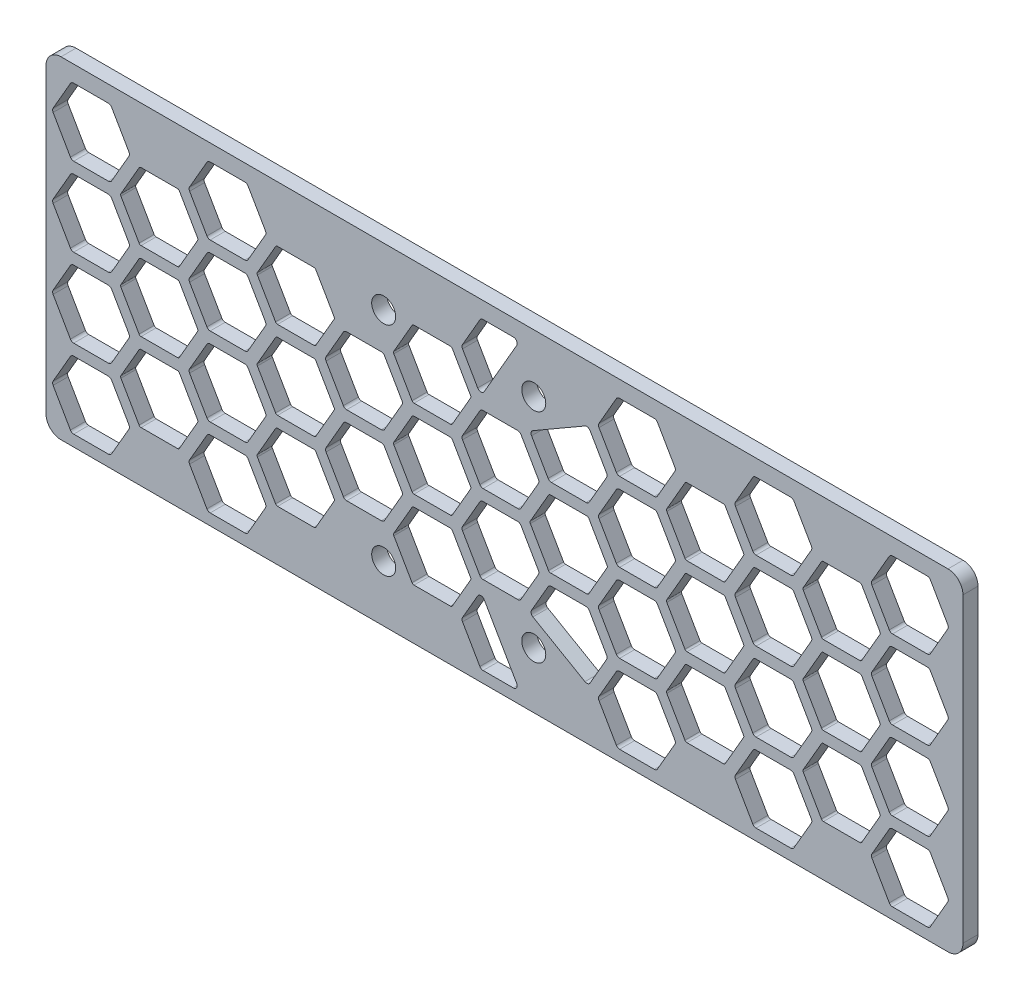
from build123d import *

# Parameters (mm, degrees)
SKETCH_2_W          = 122.2
SKETCH_2_H          = 44.2
SKETCH_2_R          = 1.6
EXTRUDE_1_DEPTH     = 2
CUT_EXTRUDE_1_DEPTH = 2
FILLET_1_R          = 2


with BuildPart() as part:
    # 草图2 → 凸台-拉伸1 (new body)
    with BuildSketch(Plane.XY):
        with Locations((-18.234957185, -14.6)):
            Rectangle(SKETCH_2_W, SKETCH_2_H)
        with Locations((-34.334957185, -0.2)):
            Circle(SKETCH_2_R, mode=Mode.SUBTRACT)
        with Locations((-14.334957185, -0.2)):
            Circle(SKETCH_2_R, mode=Mode.SUBTRACT)
        with Locations((-34.334957185, -29.2)):
            Circle(SKETCH_2_R, mode=Mode.SUBTRACT)
        with Locations((-14.334957185, -29.2)):
            Circle(SKETCH_2_R, mode=Mode.SUBTRACT)
    extrude(amount=EXTRUDE_1_DEPTH)

    # 草图3 → 切除-拉伸1 (cut)
    with BuildSketch(Plane.XY.offset(2)):
        with BuildLine():
            Line((30.732428836, -20.45), (33.041829913, -24.45))
            ThreePointArc((33.041829913, -24.45), (33.224842615, -24.633012702), (33.474842615, -24.7))
            Line((33.474842615, -24.7), (38.093644768, -24.7))
            ThreePointArc((38.093644768, -24.7), (38.343644768, -24.633012702), (38.52665747, -24.45))
            Line((38.52665747, -24.45), (40.836058547, -20.45))
            ThreePointArc((40.836058547, -20.45), (40.903045845, -20.2), (40.836058547, -19.95))
            Line((40.836058547, -19.95), (38.52665747, -15.95))
            ThreePointArc((38.52665747, -15.95), (38.343644768, -15.766987298), (38.093644768, -15.7))
            Line((38.093644768, -15.7), (33.474842615, -15.7))
            ThreePointArc((33.474842615, -15.7), (33.224842615, -15.766987298), (33.041829913, -15.95))
            Line((33.041829913, -15.95), (30.732428836, -19.95))
            ThreePointArc((30.732428836, -19.95), (30.665441538, -20.2), (30.732428836, -20.45))
        make_face()
        with BuildLine():
            Line((-78.386772041, -30.95), (-76.077370964, -34.95))
            ThreePointArc((-76.077370964, -34.95), (-75.894358262, -35.133012702), (-75.644358262, -35.2))
            Line((-75.644358262, -35.2), (-71.025556109, -35.2))
            ThreePointArc((-71.025556109, -35.2), (-70.775556109, -35.133012702), (-70.592543407, -34.95))
            Line((-70.592543407, -34.95), (-68.28314233, -30.95))
            ThreePointArc((-68.28314233, -30.95), (-68.216155032, -30.7), (-68.28314233, -30.45))
            Line((-68.28314233, -30.45), (-70.592543407, -26.45))
            ThreePointArc((-70.592543407, -26.45), (-70.775556109, -26.266987298), (-71.025556109, -26.2))
            Line((-71.025556109, -26.2), (-75.644358262, -26.2))
            ThreePointArc((-75.644358262, -26.2), (-75.894358262, -26.266987298), (-76.077370964, -26.45))
            Line((-76.077370964, -26.45), (-78.386772041, -30.45))
            ThreePointArc((-78.386772041, -30.45), (-78.453759339, -30.7), (-78.386772041, -30.95))
        make_face()
        with BuildLine():
            Line((-78.386772041, -20.45), (-76.077370964, -24.45))
            ThreePointArc((-76.077370964, -24.45), (-75.894358262, -24.633012702), (-75.644358262, -24.7))
            Line((-75.644358262, -24.7), (-71.025556109, -24.7))
            ThreePointArc((-71.025556109, -24.7), (-70.775556109, -24.633012702), (-70.592543407, -24.45))
            Line((-70.592543407, -24.45), (-68.28314233, -20.45))
            ThreePointArc((-68.28314233, -20.45), (-68.216155032, -20.2), (-68.28314233, -19.95))
            Line((-68.28314233, -19.95), (-70.592543407, -15.95))
            ThreePointArc((-70.592543407, -15.95), (-70.775556109, -15.766987298), (-71.025556109, -15.7))
            Line((-71.025556109, -15.7), (-75.644358262, -15.7))
            ThreePointArc((-75.644358262, -15.7), (-75.894358262, -15.766987298), (-76.077370964, -15.95))
            Line((-76.077370964, -15.95), (-78.386772041, -19.95))
            ThreePointArc((-78.386772041, -19.95), (-78.453759339, -20.2), (-78.386772041, -20.45))
        make_face()
        with BuildLine():
            Line((-78.386772041, -9.95), (-76.077370964, -13.95))
            ThreePointArc((-76.077370964, -13.95), (-75.894358262, -14.133012702), (-75.644358262, -14.2))
            Line((-75.644358262, -14.2), (-71.025556109, -14.2))
            ThreePointArc((-71.025556109, -14.2), (-70.775556109, -14.133012702), (-70.592543407, -13.95))
            Line((-70.592543407, -13.95), (-68.28314233, -9.95))
            ThreePointArc((-68.28314233, -9.95), (-68.216155032, -9.7), (-68.28314233, -9.45))
            Line((-68.28314233, -9.45), (-70.592543407, -5.45))
            ThreePointArc((-70.592543407, -5.45), (-70.775556109, -5.266987298), (-71.025556109, -5.2))
            Line((-71.025556109, -5.2), (-75.644358262, -5.2))
            ThreePointArc((-75.644358262, -5.2), (-75.894358262, -5.266987298), (-76.077370964, -5.45))
            Line((-76.077370964, -5.45), (-78.386772041, -9.45))
            ThreePointArc((-78.386772041, -9.45), (-78.453759339, -9.7), (-78.386772041, -9.95))
        make_face()
        with BuildLine():
            Line((-78.386772041, 0.55), (-76.077370964, -3.45))
            ThreePointArc((-76.077370964, -3.45), (-75.894358262, -3.633012702), (-75.644358262, -3.7))
            Line((-75.644358262, -3.7), (-71.025556109, -3.7))
            ThreePointArc((-71.025556109, -3.7), (-70.775556109, -3.633012702), (-70.592543407, -3.45))
            Line((-70.592543407, -3.45), (-68.28314233, 0.55))
            ThreePointArc((-68.28314233, 0.55), (-68.216155032, 0.8), (-68.28314233, 1.05))
            Line((-68.28314233, 1.05), (-70.592543407, 5.05))
            ThreePointArc((-70.592543407, 5.05), (-70.775556109, 5.233012702), (-71.025556109, 5.3))
            Line((-71.025556109, 5.3), (-75.644358262, 5.3))
            ThreePointArc((-75.644358262, 5.3), (-75.894358262, 5.233012702), (-76.077370964, 5.05))
            Line((-76.077370964, 5.05), (-78.386772041, 1.05))
            ThreePointArc((-78.386772041, 1.05), (-78.453759339, 0.8), (-78.386772041, 0.55))
        make_face()
        with BuildLine():
            Line((-69.350373014, -15.101502231), (-66.927236511, -19.298497769))
            ThreePointArc((-66.927236511, -19.298497769), (-66.81632918, -19.409405099), (-66.664826949, -19.45))
            Line((-66.664826949, -19.45), (-61.818553942, -19.45))
            ThreePointArc((-61.818553942, -19.45), (-61.667051711, -19.409405099), (-61.55614438, -19.298497769))
            Line((-61.55614438, -19.298497769), (-59.133007877, -15.101502231))
            ThreePointArc((-59.133007877, -15.101502231), (-59.092412976, -14.95), (-59.133007877, -14.798497769))
            Line((-59.133007877, -14.798497769), (-61.55614438, -10.601502231))
            ThreePointArc((-61.55614438, -10.601502231), (-61.667051711, -10.490594901), (-61.818553942, -10.45))
            Line((-61.818553942, -10.45), (-66.664826949, -10.45))
            ThreePointArc((-66.664826949, -10.45), (-66.81632918, -10.490594901), (-66.927236511, -10.601502231))
            Line((-66.927236511, -10.601502231), (-69.350373014, -14.798497769))
            ThreePointArc((-69.350373014, -14.798497769), (-69.390967915, -14.95), (-69.350373014, -15.101502231))
        make_face()
        with BuildLine():
            Line((-69.350373014, -25.601502231), (-66.927236511, -29.798497769))
            ThreePointArc((-66.927236511, -29.798497769), (-66.81632918, -29.909405099), (-66.664826949, -29.95))
            Line((-66.664826949, -29.95), (-61.818553942, -29.95))
            ThreePointArc((-61.818553942, -29.95), (-61.667051711, -29.909405099), (-61.55614438, -29.798497769))
            Line((-61.55614438, -29.798497769), (-59.133007877, -25.601502231))
            ThreePointArc((-59.133007877, -25.601502231), (-59.092412976, -25.45), (-59.133007877, -25.298497769))
            Line((-59.133007877, -25.298497769), (-61.55614438, -21.101502231))
            ThreePointArc((-61.55614438, -21.101502231), (-61.667051711, -20.990594901), (-61.818553942, -20.95))
            Line((-61.818553942, -20.95), (-66.664826949, -20.95))
            ThreePointArc((-66.664826949, -20.95), (-66.81632918, -20.990594901), (-66.927236511, -21.101502231))
            Line((-66.927236511, -21.101502231), (-69.350373014, -25.298497769))
            ThreePointArc((-69.350373014, -25.298497769), (-69.390967915, -25.45), (-69.350373014, -25.601502231))
        make_face()
        with BuildLine():
            Line((-69.350373014, -4.601502231), (-66.927236511, -8.798497769))
            ThreePointArc((-66.927236511, -8.798497769), (-66.81632918, -8.909405099), (-66.664826949, -8.95))
            Line((-66.664826949, -8.95), (-61.818553942, -8.95))
            ThreePointArc((-61.818553942, -8.95), (-61.667051711, -8.909405099), (-61.55614438, -8.798497769))
            Line((-61.55614438, -8.798497769), (-59.133007877, -4.601502231))
            ThreePointArc((-59.133007877, -4.601502231), (-59.092412976, -4.45), (-59.133007877, -4.298497769))
            Line((-59.133007877, -4.298497769), (-61.55614438, -0.101502231))
            ThreePointArc((-61.55614438, -0.101502231), (-61.667051711, 0.009405099), (-61.818553942, 0.05))
            Line((-61.818553942, 0.05), (-66.664826949, 0.05))
            ThreePointArc((-66.664826949, 0.05), (-66.81632918, 0.009405099), (-66.927236511, -0.101502231))
            Line((-66.927236511, -0.101502231), (-69.350373014, -4.298497769))
            ThreePointArc((-69.350373014, -4.298497769), (-69.390967915, -4.45), (-69.350373014, -4.601502231))
        make_face()
        with BuildLine():
            Line((-60.200238561, -30.95), (-57.890837484, -34.95))
            ThreePointArc((-57.890837484, -34.95), (-57.707824783, -35.133012702), (-57.457824783, -35.2))
            Line((-57.457824783, -35.2), (-52.839022629, -35.2))
            ThreePointArc((-52.839022629, -35.2), (-52.589022629, -35.133012702), (-52.406009927, -34.95))
            Line((-52.406009927, -34.95), (-50.09660885, -30.95))
            ThreePointArc((-50.09660885, -30.95), (-50.029621552, -30.7), (-50.09660885, -30.45))
            Line((-50.09660885, -30.45), (-52.406009927, -26.45))
            ThreePointArc((-52.406009927, -26.45), (-52.589022629, -26.266987298), (-52.839022629, -26.2))
            Line((-52.839022629, -26.2), (-57.457824783, -26.2))
            ThreePointArc((-57.457824783, -26.2), (-57.707824783, -26.266987298), (-57.890837484, -26.45))
            Line((-57.890837484, -26.45), (-60.200238561, -30.45))
            ThreePointArc((-60.200238561, -30.45), (-60.267225859, -30.7), (-60.200238561, -30.95))
        make_face()
        with BuildLine():
            Line((-60.200238561, -20.45), (-57.890837484, -24.45))
            ThreePointArc((-57.890837484, -24.45), (-57.707824783, -24.633012702), (-57.457824783, -24.7))
            Line((-57.457824783, -24.7), (-52.839022629, -24.7))
            ThreePointArc((-52.839022629, -24.7), (-52.589022629, -24.633012702), (-52.406009927, -24.45))
            Line((-52.406009927, -24.45), (-50.09660885, -20.45))
            ThreePointArc((-50.09660885, -20.45), (-50.029621552, -20.2), (-50.09660885, -19.95))
            Line((-50.09660885, -19.95), (-52.406009927, -15.95))
            ThreePointArc((-52.406009927, -15.95), (-52.589022629, -15.766987298), (-52.839022629, -15.7))
            Line((-52.839022629, -15.7), (-57.457824783, -15.7))
            ThreePointArc((-57.457824783, -15.7), (-57.707824783, -15.766987298), (-57.890837484, -15.95))
            Line((-57.890837484, -15.95), (-60.200238561, -19.95))
            ThreePointArc((-60.200238561, -19.95), (-60.267225859, -20.2), (-60.200238561, -20.45))
        make_face()
        with BuildLine():
            Line((-60.200238561, -9.95), (-57.890837484, -13.95))
            ThreePointArc((-57.890837484, -13.95), (-57.707824783, -14.133012702), (-57.457824783, -14.2))
            Line((-57.457824783, -14.2), (-52.839022629, -14.2))
            ThreePointArc((-52.839022629, -14.2), (-52.589022629, -14.133012702), (-52.406009927, -13.95))
            Line((-52.406009927, -13.95), (-50.09660885, -9.95))
            ThreePointArc((-50.09660885, -9.95), (-50.029621552, -9.7), (-50.09660885, -9.45))
            Line((-50.09660885, -9.45), (-52.406009927, -5.45))
            ThreePointArc((-52.406009927, -5.45), (-52.589022629, -5.266987298), (-52.839022629, -5.2))
            Line((-52.839022629, -5.2), (-57.457824783, -5.2))
            ThreePointArc((-57.457824783, -5.2), (-57.707824783, -5.266987298), (-57.890837484, -5.45))
            Line((-57.890837484, -5.45), (-60.200238561, -9.45))
            ThreePointArc((-60.200238561, -9.45), (-60.267225859, -9.7), (-60.200238561, -9.95))
        make_face()
        with BuildLine():
            Line((-60.200238561, 0.55), (-57.890837484, -3.45))
            ThreePointArc((-57.890837484, -3.45), (-57.707824783, -3.633012702), (-57.457824783, -3.7))
            Line((-57.457824783, -3.7), (-52.839022629, -3.7))
            ThreePointArc((-52.839022629, -3.7), (-52.589022629, -3.633012702), (-52.406009927, -3.45))
            Line((-52.406009927, -3.45), (-50.09660885, 0.55))
            ThreePointArc((-50.09660885, 0.55), (-50.029621552, 0.8), (-50.09660885, 1.05))
            Line((-50.09660885, 1.05), (-52.406009927, 5.05))
            ThreePointArc((-52.406009927, 5.05), (-52.589022629, 5.233012702), (-52.839022629, 5.3))
            Line((-52.839022629, 5.3), (-57.457824783, 5.3))
            ThreePointArc((-57.457824783, 5.3), (-57.707824783, 5.233012702), (-57.890837484, 5.05))
            Line((-57.890837484, 5.05), (-60.200238561, 1.05))
            ThreePointArc((-60.200238561, 1.05), (-60.267225859, 0.8), (-60.200238561, 0.55))
        make_face()
        with BuildLine():
            Line((-51.163839535, -15.101502231), (-48.740703032, -19.298497769))
            ThreePointArc((-48.740703032, -19.298497769), (-48.629795701, -19.409405099), (-48.478293469, -19.45))
            Line((-48.478293469, -19.45), (-43.632020463, -19.45))
            ThreePointArc((-43.632020463, -19.45), (-43.480518232, -19.409405099), (-43.369610901, -19.298497769))
            Line((-43.369610901, -19.298497769), (-40.946474397, -15.101502231))
            ThreePointArc((-40.946474397, -15.101502231), (-40.905879497, -14.95), (-40.946474397, -14.798497769))
            Line((-40.946474397, -14.798497769), (-43.369610901, -10.601502231))
            ThreePointArc((-43.369610901, -10.601502231), (-43.480518232, -10.490594901), (-43.632020463, -10.45))
            Line((-43.632020463, -10.45), (-48.478293469, -10.45))
            ThreePointArc((-48.478293469, -10.45), (-48.629795701, -10.490594901), (-48.740703032, -10.601502231))
            Line((-48.740703032, -10.601502231), (-51.163839535, -14.798497769))
            ThreePointArc((-51.163839535, -14.798497769), (-51.204434435, -14.95), (-51.163839535, -15.101502231))
        make_face()
        with BuildLine():
            Line((-51.163839535, -25.601502231), (-48.740703032, -29.798497769))
            ThreePointArc((-48.740703032, -29.798497769), (-48.629795701, -29.909405099), (-48.478293469, -29.95))
            Line((-48.478293469, -29.95), (-43.632020463, -29.95))
            ThreePointArc((-43.632020463, -29.95), (-43.480518232, -29.909405099), (-43.369610901, -29.798497769))
            Line((-43.369610901, -29.798497769), (-40.946474397, -25.601502231))
            ThreePointArc((-40.946474397, -25.601502231), (-40.905879497, -25.45), (-40.946474397, -25.298497769))
            Line((-40.946474397, -25.298497769), (-43.369610901, -21.101502231))
            ThreePointArc((-43.369610901, -21.101502231), (-43.480518232, -20.990594901), (-43.632020463, -20.95))
            Line((-43.632020463, -20.95), (-48.478293469, -20.95))
            ThreePointArc((-48.478293469, -20.95), (-48.629795701, -20.990594901), (-48.740703032, -21.101502231))
            Line((-48.740703032, -21.101502231), (-51.163839535, -25.298497769))
            ThreePointArc((-51.163839535, -25.298497769), (-51.204434435, -25.45), (-51.163839535, -25.601502231))
        make_face()
        with BuildLine():
            Line((-51.163839535, -4.601502231), (-48.740703032, -8.798497769))
            ThreePointArc((-48.740703032, -8.798497769), (-48.629795701, -8.909405099), (-48.478293469, -8.95))
            Line((-48.478293469, -8.95), (-43.632020463, -8.95))
            ThreePointArc((-43.632020463, -8.95), (-43.480518232, -8.909405099), (-43.369610901, -8.798497769))
            Line((-43.369610901, -8.798497769), (-40.946474397, -4.601502231))
            ThreePointArc((-40.946474397, -4.601502231), (-40.905879497, -4.45), (-40.946474397, -4.298497769))
            Line((-40.946474397, -4.298497769), (-43.369610901, -0.101502231))
            ThreePointArc((-43.369610901, -0.101502231), (-43.480518232, 0.009405099), (-43.632020463, 0.05))
            Line((-43.632020463, 0.05), (-48.478293469, 0.05))
            ThreePointArc((-48.478293469, 0.05), (-48.629795701, 0.009405099), (-48.740703032, -0.101502231))
            Line((-48.740703032, -0.101502231), (-51.163839535, -4.298497769))
            ThreePointArc((-51.163839535, -4.298497769), (-51.204434435, -4.45), (-51.163839535, -4.601502231))
        make_face()
        with BuildLine():
            Line((-42.013705082, -20.45), (-39.704304005, -24.45))
            ThreePointArc((-39.704304005, -24.45), (-39.521291303, -24.633012702), (-39.271291303, -24.7))
            Line((-39.271291303, -24.7), (-34.65248915, -24.7))
            ThreePointArc((-34.65248915, -24.7), (-34.40248915, -24.633012702), (-34.219476448, -24.45))
            Line((-34.219476448, -24.45), (-31.910075371, -20.45))
            ThreePointArc((-31.910075371, -20.45), (-31.843088073, -20.2), (-31.910075371, -19.95))
            Line((-31.910075371, -19.95), (-34.219476448, -15.95))
            ThreePointArc((-34.219476448, -15.95), (-34.40248915, -15.766987298), (-34.65248915, -15.7))
            Line((-34.65248915, -15.7), (-39.271291303, -15.7))
            ThreePointArc((-39.271291303, -15.7), (-39.521291303, -15.766987298), (-39.704304005, -15.95))
            Line((-39.704304005, -15.95), (-42.013705082, -19.95))
            ThreePointArc((-42.013705082, -19.95), (-42.08069238, -20.2), (-42.013705082, -20.45))
        make_face()
        with BuildLine():
            Line((-42.013705082, -9.95), (-39.704304005, -13.95))
            ThreePointArc((-39.704304005, -13.95), (-39.521291303, -14.133012702), (-39.271291303, -14.2))
            Line((-39.271291303, -14.2), (-34.65248915, -14.2))
            ThreePointArc((-34.65248915, -14.2), (-34.40248915, -14.133012702), (-34.219476448, -13.95))
            Line((-34.219476448, -13.95), (-31.910075371, -9.95))
            ThreePointArc((-31.910075371, -9.95), (-31.843088073, -9.7), (-31.910075371, -9.45))
            Line((-31.910075371, -9.45), (-34.219476448, -5.45))
            ThreePointArc((-34.219476448, -5.45), (-34.40248915, -5.266987298), (-34.65248915, -5.2))
            Line((-34.65248915, -5.2), (-39.271291303, -5.2))
            ThreePointArc((-39.271291303, -5.2), (-39.521291303, -5.266987298), (-39.704304005, -5.45))
            Line((-39.704304005, -5.45), (-42.013705082, -9.45))
            ThreePointArc((-42.013705082, -9.45), (-42.08069238, -9.7), (-42.013705082, -9.95))
        make_face()
        with BuildLine():
            Line((-32.977306055, -15.101502231), (-30.554169552, -19.298497769))
            ThreePointArc((-30.554169552, -19.298497769), (-30.443262221, -19.409405099), (-30.29175999, -19.45))
            Line((-30.29175999, -19.45), (-25.445486983, -19.45))
            ThreePointArc((-25.445486983, -19.45), (-25.293984752, -19.409405099), (-25.183077421, -19.298497769))
            Line((-25.183077421, -19.298497769), (-22.759940918, -15.101502231))
            ThreePointArc((-22.759940918, -15.101502231), (-22.719346017, -14.95), (-22.759940918, -14.798497769))
            Line((-22.759940918, -14.798497769), (-25.183077421, -10.601502231))
            ThreePointArc((-25.183077421, -10.601502231), (-25.293984752, -10.490594901), (-25.445486983, -10.45))
            Line((-25.445486983, -10.45), (-30.29175999, -10.45))
            ThreePointArc((-30.29175999, -10.45), (-30.443262221, -10.490594901), (-30.554169552, -10.601502231))
            Line((-30.554169552, -10.601502231), (-32.977306055, -14.798497769))
            ThreePointArc((-32.977306055, -14.798497769), (-33.017900956, -14.95), (-32.977306055, -15.101502231))
        make_face()
        with BuildLine():
            Line((-32.977306055, -25.601502231), (-30.554169552, -29.798497769))
            ThreePointArc((-30.554169552, -29.798497769), (-30.443262221, -29.909405099), (-30.29175999, -29.95))
            Line((-30.29175999, -29.95), (-25.445486983, -29.95))
            ThreePointArc((-25.445486983, -29.95), (-25.293984752, -29.909405099), (-25.183077421, -29.798497769))
            Line((-25.183077421, -29.798497769), (-22.759940918, -25.601502231))
            ThreePointArc((-22.759940918, -25.601502231), (-22.719346017, -25.45), (-22.759940918, -25.298497769))
            Line((-22.759940918, -25.298497769), (-25.183077421, -21.101502231))
            ThreePointArc((-25.183077421, -21.101502231), (-25.293984752, -20.990594901), (-25.445486983, -20.95))
            Line((-25.445486983, -20.95), (-30.29175999, -20.95))
            ThreePointArc((-30.29175999, -20.95), (-30.443262221, -20.990594901), (-30.554169552, -21.101502231))
            Line((-30.554169552, -21.101502231), (-32.977306055, -25.298497769))
            ThreePointArc((-32.977306055, -25.298497769), (-33.017900956, -25.45), (-32.977306055, -25.601502231))
        make_face()
        with BuildLine():
            Line((-32.977306055, -4.601502231), (-30.554169552, -8.798497769))
            ThreePointArc((-30.554169552, -8.798497769), (-30.443262221, -8.909405099), (-30.29175999, -8.95))
            Line((-30.29175999, -8.95), (-25.445486983, -8.95))
            ThreePointArc((-25.445486983, -8.95), (-25.293984752, -8.909405099), (-25.183077421, -8.798497769))
            Line((-25.183077421, -8.798497769), (-22.759940918, -4.601502231))
            ThreePointArc((-22.759940918, -4.601502231), (-22.719346017, -4.45), (-22.759940918, -4.298497769))
            Line((-22.759940918, -4.298497769), (-25.183077421, -0.101502231))
            ThreePointArc((-25.183077421, -0.101502231), (-25.293984752, 0.009405099), (-25.445486983, 0.05))
            Line((-25.445486983, 0.05), (-30.29175999, 0.05))
            ThreePointArc((-30.29175999, 0.05), (-30.443262221, 0.009405099), (-30.554169552, -0.101502231))
            Line((-30.554169552, -0.101502231), (-32.977306055, -4.298497769))
            ThreePointArc((-32.977306055, -4.298497769), (-33.017900956, -4.45), (-32.977306055, -4.601502231))
        make_face()
        with BuildLine():
            Line((-23.827171602, -20.45), (-21.517770526, -24.45))
            ThreePointArc((-21.517770526, -24.45), (-21.334757824, -24.633012702), (-21.084757824, -24.7))
            Line((-21.084757824, -24.7), (-16.46595567, -24.7))
            ThreePointArc((-16.46595567, -24.7), (-16.21595567, -24.633012702), (-16.032942968, -24.45))
            Line((-16.032942968, -24.45), (-13.723541891, -20.45))
            ThreePointArc((-13.723541891, -20.45), (-13.656554593, -20.2), (-13.723541891, -19.95))
            Line((-13.723541891, -19.95), (-16.032942968, -15.95))
            ThreePointArc((-16.032942968, -15.95), (-16.21595567, -15.766987298), (-16.46595567, -15.7))
            Line((-16.46595567, -15.7), (-21.084757824, -15.7))
            ThreePointArc((-21.084757824, -15.7), (-21.334757824, -15.766987298), (-21.517770526, -15.95))
            Line((-21.517770526, -15.95), (-23.827171602, -19.95))
            ThreePointArc((-23.827171602, -19.95), (-23.8941589, -20.2), (-23.827171602, -20.45))
        make_face()
        with BuildLine():
            Line((-23.827171602, -9.95), (-21.517770526, -13.95))
            ThreePointArc((-21.517770526, -13.95), (-21.334757824, -14.133012702), (-21.084757824, -14.2))
            Line((-21.084757824, -14.2), (-16.46595567, -14.2))
            ThreePointArc((-16.46595567, -14.2), (-16.21595567, -14.133012702), (-16.032942968, -13.95))
            Line((-16.032942968, -13.95), (-13.723541891, -9.95))
            ThreePointArc((-13.723541891, -9.95), (-13.656554593, -9.7), (-13.723541891, -9.45))
            Line((-13.723541891, -9.45), (-16.032942968, -5.45))
            ThreePointArc((-16.032942968, -5.45), (-16.21595567, -5.266987298), (-16.46595567, -5.2))
            Line((-16.46595567, -5.2), (-21.084757824, -5.2))
            ThreePointArc((-21.084757824, -5.2), (-21.334757824, -5.266987298), (-21.517770526, -5.45))
            Line((-21.517770526, -5.45), (-23.827171602, -9.45))
            ThreePointArc((-23.827171602, -9.45), (-23.8941589, -9.7), (-23.827171602, -9.95))
        make_face()
        with BuildLine():
            Line((-14.790772576, -15.101502231), (-12.367636073, -19.298497769))
            ThreePointArc((-12.367636073, -19.298497769), (-12.256728742, -19.409405099), (-12.10522651, -19.45))
            Line((-12.10522651, -19.45), (-7.258953504, -19.45))
            ThreePointArc((-7.258953504, -19.45), (-7.107451273, -19.409405099), (-6.996543942, -19.298497769))
            Line((-6.996543942, -19.298497769), (-4.573407439, -15.101502231))
            ThreePointArc((-4.573407439, -15.101502231), (-4.532812538, -14.95), (-4.573407439, -14.798497769))
            Line((-4.573407439, -14.798497769), (-6.996543942, -10.601502231))
            ThreePointArc((-6.996543942, -10.601502231), (-7.107451273, -10.490594901), (-7.258953504, -10.45))
            Line((-7.258953504, -10.45), (-12.10522651, -10.45))
            ThreePointArc((-12.10522651, -10.45), (-12.256728742, -10.490594901), (-12.367636073, -10.601502231))
            Line((-12.367636073, -10.601502231), (-14.790772576, -14.798497769))
            ThreePointArc((-14.790772576, -14.798497769), (-14.831367476, -14.95), (-14.790772576, -15.101502231))
        make_face()
        with BuildLine():
            Line((-5.640638123, -30.95), (-3.331237046, -34.95))
            ThreePointArc((-3.331237046, -34.95), (-3.148224344, -35.133012702), (-2.898224344, -35.2))
            Line((-2.898224344, -35.2), (1.720577809, -35.2))
            ThreePointArc((1.720577809, -35.2), (1.970577809, -35.133012702), (2.153590511, -34.95))
            Line((2.153590511, -34.95), (4.462991588, -30.95))
            ThreePointArc((4.462991588, -30.95), (4.529978886, -30.7), (4.462991588, -30.45))
            Line((4.462991588, -30.45), (2.153590511, -26.45))
            ThreePointArc((2.153590511, -26.45), (1.970577809, -26.266987298), (1.720577809, -26.2))
            Line((1.720577809, -26.2), (-2.898224344, -26.2))
            ThreePointArc((-2.898224344, -26.2), (-3.148224344, -26.266987298), (-3.331237046, -26.45))
            Line((-3.331237046, -26.45), (-5.640638123, -30.45))
            ThreePointArc((-5.640638123, -30.45), (-5.707625421, -30.7), (-5.640638123, -30.95))
        make_face()
        with BuildLine():
            Line((-5.640638123, -20.45), (-3.331237046, -24.45))
            ThreePointArc((-3.331237046, -24.45), (-3.148224344, -24.633012702), (-2.898224344, -24.7))
            Line((-2.898224344, -24.7), (1.720577809, -24.7))
            ThreePointArc((1.720577809, -24.7), (1.970577809, -24.633012702), (2.153590511, -24.45))
            Line((2.153590511, -24.45), (4.462991588, -20.45))
            ThreePointArc((4.462991588, -20.45), (4.529978886, -20.2), (4.462991588, -19.95))
            Line((4.462991588, -19.95), (2.153590511, -15.95))
            ThreePointArc((2.153590511, -15.95), (1.970577809, -15.766987298), (1.720577809, -15.7))
            Line((1.720577809, -15.7), (-2.898224344, -15.7))
            ThreePointArc((-2.898224344, -15.7), (-3.148224344, -15.766987298), (-3.331237046, -15.95))
            Line((-3.331237046, -15.95), (-5.640638123, -19.95))
            ThreePointArc((-5.640638123, -19.95), (-5.707625421, -20.2), (-5.640638123, -20.45))
        make_face()
        with BuildLine():
            Line((-5.640638123, -9.95), (-3.331237046, -13.95))
            ThreePointArc((-3.331237046, -13.95), (-3.148224344, -14.133012702), (-2.898224344, -14.2))
            Line((-2.898224344, -14.2), (1.720577809, -14.2))
            ThreePointArc((1.720577809, -14.2), (1.970577809, -14.133012702), (2.153590511, -13.95))
            Line((2.153590511, -13.95), (4.462991588, -9.95))
            ThreePointArc((4.462991588, -9.95), (4.529978886, -9.7), (4.462991588, -9.45))
            Line((4.462991588, -9.45), (2.153590511, -5.45))
            ThreePointArc((2.153590511, -5.45), (1.970577809, -5.266987298), (1.720577809, -5.2))
            Line((1.720577809, -5.2), (-2.898224344, -5.2))
            ThreePointArc((-2.898224344, -5.2), (-3.148224344, -5.266987298), (-3.331237046, -5.45))
            Line((-3.331237046, -5.45), (-5.640638123, -9.45))
            ThreePointArc((-5.640638123, -9.45), (-5.707625421, -9.7), (-5.640638123, -9.95))
        make_face()
        with BuildLine():
            Line((-5.640638123, 0.55), (-3.331237046, -3.45))
            ThreePointArc((-3.331237046, -3.45), (-3.148224344, -3.633012702), (-2.898224344, -3.7))
            Line((-2.898224344, -3.7), (1.720577809, -3.7))
            ThreePointArc((1.720577809, -3.7), (1.970577809, -3.633012702), (2.153590511, -3.45))
            Line((2.153590511, -3.45), (4.462991588, 0.55))
            ThreePointArc((4.462991588, 0.55), (4.529978886, 0.8), (4.462991588, 1.05))
            Line((4.462991588, 1.05), (2.153590511, 5.05))
            ThreePointArc((2.153590511, 5.05), (1.970577809, 5.233012702), (1.720577809, 5.3))
            Line((1.720577809, 5.3), (-2.898224344, 5.3))
            ThreePointArc((-2.898224344, 5.3), (-3.148224344, 5.233012702), (-3.331237046, 5.05))
            Line((-3.331237046, 5.05), (-5.640638123, 1.05))
            ThreePointArc((-5.640638123, 1.05), (-5.707625421, 0.8), (-5.640638123, 0.55))
        make_face()
        with BuildLine():
            Line((3.395760904, -15.101502231), (5.818897407, -19.298497769))
            ThreePointArc((5.818897407, -19.298497769), (5.929804738, -19.409405099), (6.081306969, -19.45))
            Line((6.081306969, -19.45), (10.927579976, -19.45))
            ThreePointArc((10.927579976, -19.45), (11.079082207, -19.409405099), (11.189989538, -19.298497769))
            Line((11.189989538, -19.298497769), (13.613126041, -15.101502231))
            ThreePointArc((13.613126041, -15.101502231), (13.653720942, -14.95), (13.613126041, -14.798497769))
            Line((13.613126041, -14.798497769), (11.189989538, -10.601502231))
            ThreePointArc((11.189989538, -10.601502231), (11.079082207, -10.490594901), (10.927579976, -10.45))
            Line((10.927579976, -10.45), (6.081306969, -10.45))
            ThreePointArc((6.081306969, -10.45), (5.929804738, -10.490594901), (5.818897407, -10.601502231))
            Line((5.818897407, -10.601502231), (3.395760904, -14.798497769))
            ThreePointArc((3.395760904, -14.798497769), (3.355166003, -14.95), (3.395760904, -15.101502231))
        make_face()
        with BuildLine():
            Line((3.395760904, -25.601502231), (5.818897407, -29.798497769))
            ThreePointArc((5.818897407, -29.798497769), (5.929804738, -29.909405099), (6.081306969, -29.95))
            Line((6.081306969, -29.95), (10.927579976, -29.95))
            ThreePointArc((10.927579976, -29.95), (11.079082207, -29.909405099), (11.189989538, -29.798497769))
            Line((11.189989538, -29.798497769), (13.613126041, -25.601502231))
            ThreePointArc((13.613126041, -25.601502231), (13.653720942, -25.45), (13.613126041, -25.298497769))
            Line((13.613126041, -25.298497769), (11.189989538, -21.101502231))
            ThreePointArc((11.189989538, -21.101502231), (11.079082207, -20.990594901), (10.927579976, -20.95))
            Line((10.927579976, -20.95), (6.081306969, -20.95))
            ThreePointArc((6.081306969, -20.95), (5.929804738, -20.990594901), (5.818897407, -21.101502231))
            Line((5.818897407, -21.101502231), (3.395760904, -25.298497769))
            ThreePointArc((3.395760904, -25.298497769), (3.355166003, -25.45), (3.395760904, -25.601502231))
        make_face()
        with BuildLine():
            Line((3.395760904, -4.601502231), (5.818897407, -8.798497769))
            ThreePointArc((5.818897407, -8.798497769), (5.929804738, -8.909405099), (6.081306969, -8.95))
            Line((6.081306969, -8.95), (10.927579976, -8.95))
            ThreePointArc((10.927579976, -8.95), (11.079082207, -8.909405099), (11.189989538, -8.798497769))
            Line((11.189989538, -8.798497769), (13.613126041, -4.601502231))
            ThreePointArc((13.613126041, -4.601502231), (13.653720942, -4.45), (13.613126041, -4.298497769))
            Line((13.613126041, -4.298497769), (11.189989538, -0.101502231))
            ThreePointArc((11.189989538, -0.101502231), (11.079082207, 0.009405099), (10.927579976, 0.05))
            Line((10.927579976, 0.05), (6.081306969, 0.05))
            ThreePointArc((6.081306969, 0.05), (5.929804738, 0.009405099), (5.818897407, -0.101502231))
            Line((5.818897407, -0.101502231), (3.395760904, -4.298497769))
            ThreePointArc((3.395760904, -4.298497769), (3.355166003, -4.45), (3.395760904, -4.601502231))
        make_face()
        with BuildLine():
            Line((12.545895357, -30.95), (14.855296433, -34.95))
            ThreePointArc((14.855296433, -34.95), (15.038309135, -35.133012702), (15.288309135, -35.2))
            Line((15.288309135, -35.2), (19.907111289, -35.2))
            ThreePointArc((19.907111289, -35.2), (20.157111289, -35.133012702), (20.340123991, -34.95))
            Line((20.340123991, -34.95), (22.649525067, -30.95))
            ThreePointArc((22.649525067, -30.95), (22.716512366, -30.7), (22.649525067, -30.45))
            Line((22.649525067, -30.45), (20.340123991, -26.45))
            ThreePointArc((20.340123991, -26.45), (20.157111289, -26.266987298), (19.907111289, -26.2))
            Line((19.907111289, -26.2), (15.288309135, -26.2))
            ThreePointArc((15.288309135, -26.2), (15.038309135, -26.266987298), (14.855296433, -26.45))
            Line((14.855296433, -26.45), (12.545895357, -30.45))
            ThreePointArc((12.545895357, -30.45), (12.478908059, -30.7), (12.545895357, -30.95))
        make_face()
        with BuildLine():
            Line((12.545895357, -20.45), (14.855296433, -24.45))
            ThreePointArc((14.855296433, -24.45), (15.038309135, -24.633012702), (15.288309135, -24.7))
            Line((15.288309135, -24.7), (19.907111289, -24.7))
            ThreePointArc((19.907111289, -24.7), (20.157111289, -24.633012702), (20.340123991, -24.45))
            Line((20.340123991, -24.45), (22.649525067, -20.45))
            ThreePointArc((22.649525067, -20.45), (22.716512366, -20.2), (22.649525067, -19.95))
            Line((22.649525067, -19.95), (20.340123991, -15.95))
            ThreePointArc((20.340123991, -15.95), (20.157111289, -15.766987298), (19.907111289, -15.7))
            Line((19.907111289, -15.7), (15.288309135, -15.7))
            ThreePointArc((15.288309135, -15.7), (15.038309135, -15.766987298), (14.855296433, -15.95))
            Line((14.855296433, -15.95), (12.545895357, -19.95))
            ThreePointArc((12.545895357, -19.95), (12.478908059, -20.2), (12.545895357, -20.45))
        make_face()
        with BuildLine():
            Line((12.545895357, -9.95), (14.855296433, -13.95))
            ThreePointArc((14.855296433, -13.95), (15.038309135, -14.133012702), (15.288309135, -14.2))
            Line((15.288309135, -14.2), (19.907111289, -14.2))
            ThreePointArc((19.907111289, -14.2), (20.157111289, -14.133012702), (20.340123991, -13.95))
            Line((20.340123991, -13.95), (22.649525067, -9.95))
            ThreePointArc((22.649525067, -9.95), (22.716512366, -9.7), (22.649525067, -9.45))
            Line((22.649525067, -9.45), (20.340123991, -5.45))
            ThreePointArc((20.340123991, -5.45), (20.157111289, -5.266987298), (19.907111289, -5.2))
            Line((19.907111289, -5.2), (15.288309135, -5.2))
            ThreePointArc((15.288309135, -5.2), (15.038309135, -5.266987298), (14.855296433, -5.45))
            Line((14.855296433, -5.45), (12.545895357, -9.45))
            ThreePointArc((12.545895357, -9.45), (12.478908059, -9.7), (12.545895357, -9.95))
        make_face()
        with BuildLine():
            Line((12.545895357, 0.55), (14.855296433, -3.45))
            ThreePointArc((14.855296433, -3.45), (15.038309135, -3.633012702), (15.288309135, -3.7))
            Line((15.288309135, -3.7), (19.907111289, -3.7))
            ThreePointArc((19.907111289, -3.7), (20.157111289, -3.633012702), (20.340123991, -3.45))
            Line((20.340123991, -3.45), (22.649525067, 0.55))
            ThreePointArc((22.649525067, 0.55), (22.716512366, 0.8), (22.649525067, 1.05))
            Line((22.649525067, 1.05), (20.340123991, 5.05))
            ThreePointArc((20.340123991, 5.05), (20.157111289, 5.233012702), (19.907111289, 5.3))
            Line((19.907111289, 5.3), (15.288309135, 5.3))
            ThreePointArc((15.288309135, 5.3), (15.038309135, 5.233012702), (14.855296433, 5.05))
            Line((14.855296433, 5.05), (12.545895357, 1.05))
            ThreePointArc((12.545895357, 1.05), (12.478908059, 0.8), (12.545895357, 0.55))
        make_face()
        with BuildLine():
            Line((21.582294383, -15.101502231), (24.005430886, -19.298497769))
            ThreePointArc((24.005430886, -19.298497769), (24.116338217, -19.409405099), (24.267840449, -19.45))
            Line((24.267840449, -19.45), (29.114113455, -19.45))
            ThreePointArc((29.114113455, -19.45), (29.265615686, -19.409405099), (29.376523017, -19.298497769))
            Line((29.376523017, -19.298497769), (31.79965952, -15.101502231))
            ThreePointArc((31.79965952, -15.101502231), (31.840254421, -14.95), (31.79965952, -14.798497769))
            Line((31.79965952, -14.798497769), (29.376523017, -10.601502231))
            ThreePointArc((29.376523017, -10.601502231), (29.265615686, -10.490594901), (29.114113455, -10.45))
            Line((29.114113455, -10.45), (24.267840449, -10.45))
            ThreePointArc((24.267840449, -10.45), (24.116338217, -10.490594901), (24.005430886, -10.601502231))
            Line((24.005430886, -10.601502231), (21.582294383, -14.798497769))
            ThreePointArc((21.582294383, -14.798497769), (21.541699483, -14.95), (21.582294383, -15.101502231))
        make_face()
        with BuildLine():
            Line((21.582294383, -25.601502231), (24.005430886, -29.798497769))
            ThreePointArc((24.005430886, -29.798497769), (24.116338217, -29.909405099), (24.267840449, -29.95))
            Line((24.267840449, -29.95), (29.114113455, -29.95))
            ThreePointArc((29.114113455, -29.95), (29.265615686, -29.909405099), (29.376523017, -29.798497769))
            Line((29.376523017, -29.798497769), (31.79965952, -25.601502231))
            ThreePointArc((31.79965952, -25.601502231), (31.840254421, -25.45), (31.79965952, -25.298497769))
            Line((31.79965952, -25.298497769), (29.376523017, -21.101502231))
            ThreePointArc((29.376523017, -21.101502231), (29.265615686, -20.990594901), (29.114113455, -20.95))
            Line((29.114113455, -20.95), (24.267840449, -20.95))
            ThreePointArc((24.267840449, -20.95), (24.116338217, -20.990594901), (24.005430886, -21.101502231))
            Line((24.005430886, -21.101502231), (21.582294383, -25.298497769))
            ThreePointArc((21.582294383, -25.298497769), (21.541699483, -25.45), (21.582294383, -25.601502231))
        make_face()
        with BuildLine():
            Line((21.582294383, -4.601502231), (24.005430886, -8.798497769))
            ThreePointArc((24.005430886, -8.798497769), (24.116338217, -8.909405099), (24.267840449, -8.95))
            Line((24.267840449, -8.95), (29.114113455, -8.95))
            ThreePointArc((29.114113455, -8.95), (29.265615686, -8.909405099), (29.376523017, -8.798497769))
            Line((29.376523017, -8.798497769), (31.79965952, -4.601502231))
            ThreePointArc((31.79965952, -4.601502231), (31.840254421, -4.45), (31.79965952, -4.298497769))
            Line((31.79965952, -4.298497769), (29.376523017, -0.101502231))
            ThreePointArc((29.376523017, -0.101502231), (29.265615686, 0.009405099), (29.114113455, 0.05))
            Line((29.114113455, 0.05), (24.267840449, 0.05))
            ThreePointArc((24.267840449, 0.05), (24.116338217, 0.009405099), (24.005430886, -0.101502231))
            Line((24.005430886, -0.101502231), (21.582294383, -4.298497769))
            ThreePointArc((21.582294383, -4.298497769), (21.541699483, -4.45), (21.582294383, -4.601502231))
        make_face()
        with BuildLine():
            Line((30.732428836, -30.95), (33.041829913, -34.95))
            ThreePointArc((33.041829913, -34.95), (33.224842615, -35.133012702), (33.474842615, -35.2))
            Line((33.474842615, -35.2), (38.093644768, -35.2))
            ThreePointArc((38.093644768, -35.2), (38.343644768, -35.133012702), (38.52665747, -34.95))
            Line((38.52665747, -34.95), (40.836058547, -30.95))
            ThreePointArc((40.836058547, -30.95), (40.903045845, -30.7), (40.836058547, -30.45))
            Line((40.836058547, -30.45), (38.52665747, -26.45))
            ThreePointArc((38.52665747, -26.45), (38.343644768, -26.266987298), (38.093644768, -26.2))
            Line((38.093644768, -26.2), (33.474842615, -26.2))
            ThreePointArc((33.474842615, -26.2), (33.224842615, -26.266987298), (33.041829913, -26.45))
            Line((33.041829913, -26.45), (30.732428836, -30.45))
            ThreePointArc((30.732428836, -30.45), (30.665441538, -30.7), (30.732428836, -30.95))
        make_face()
        with BuildLine():
            Line((30.732428836, -9.95), (33.041829913, -13.95))
            ThreePointArc((33.041829913, -13.95), (33.224842615, -14.133012702), (33.474842615, -14.2))
            Line((33.474842615, -14.2), (38.093644768, -14.2))
            ThreePointArc((38.093644768, -14.2), (38.343644768, -14.133012702), (38.52665747, -13.95))
            Line((38.52665747, -13.95), (40.836058547, -9.95))
            ThreePointArc((40.836058547, -9.95), (40.903045845, -9.7), (40.836058547, -9.45))
            Line((40.836058547, -9.45), (38.52665747, -5.45))
            ThreePointArc((38.52665747, -5.45), (38.343644768, -5.266987298), (38.093644768, -5.2))
            Line((38.093644768, -5.2), (33.474842615, -5.2))
            ThreePointArc((33.474842615, -5.2), (33.224842615, -5.266987298), (33.041829913, -5.45))
            Line((33.041829913, -5.45), (30.732428836, -9.45))
            ThreePointArc((30.732428836, -9.45), (30.665441538, -9.7), (30.732428836, -9.95))
        make_face()
        with BuildLine():
            Line((30.732428836, 0.55), (33.041829913, -3.45))
            ThreePointArc((33.041829913, -3.45), (33.224842615, -3.633012702), (33.474842615, -3.7))
            Line((33.474842615, -3.7), (38.093644768, -3.7))
            ThreePointArc((38.093644768, -3.7), (38.343644768, -3.633012702), (38.52665747, -3.45))
            Line((38.52665747, -3.45), (40.836058547, 0.55))
            ThreePointArc((40.836058547, 0.55), (40.903045845, 0.8), (40.836058547, 1.05))
            Line((40.836058547, 1.05), (38.52665747, 5.05))
            ThreePointArc((38.52665747, 5.05), (38.343644768, 5.233012702), (38.093644768, 5.3))
            Line((38.093644768, 5.3), (33.474842615, 5.3))
            ThreePointArc((33.474842615, 5.3), (33.224842615, 5.233012702), (33.041829913, 5.05))
            Line((33.041829913, 5.05), (30.732428836, 1.05))
            ThreePointArc((30.732428836, 1.05), (30.665441538, 0.8), (30.732428836, 0.55))
        make_face()
        with BuildLine():
            Line((-20.940420256, -26.95), (-16.610293237, -34.45))
            ThreePointArc((-16.610293237, -34.45), (-16.610293237, -34.95), (-17.043305939, -35.2))
            Line((-17.043305939, -35.2), (-21.084757824, -35.2))
            ThreePointArc((-21.084757824, -35.2), (-21.334757824, -35.133012702), (-21.517770526, -34.95))
            Line((-21.517770526, -34.95), (-23.827171602, -30.95))
            ThreePointArc((-23.827171602, -30.95), (-23.8941589, -30.7), (-23.827171602, -30.45))
            Line((-23.827171602, -30.45), (-21.80644566, -26.95))
            ThreePointArc((-21.80644566, -26.95), (-21.373432958, -26.7), (-20.940420256, -26.95))
        make_face()
        with BuildLine():
            Line((-14.445229728, -25.7), (-7.517026498, -29.7))
            ThreePointArc((-7.517026498, -29.7), (-7.137616975, -29.749950211), (-6.834013796, -29.516987298))
            Line((-6.834013796, -29.516987298), (-4.630275152, -25.7))
            ThreePointArc((-4.630275152, -25.7), (-4.563287854, -25.45), (-4.630275152, -25.2))
            Line((-4.630275152, -25.2), (-6.939676229, -21.2))
            ThreePointArc((-6.939676229, -21.2), (-7.12268893, -21.016987298), (-7.37268893, -20.95))
            Line((-7.37268893, -20.95), (-11.991491084, -20.95))
            ThreePointArc((-11.991491084, -20.95), (-12.241491084, -21.016987298), (-12.424503786, -21.2))
            Line((-12.424503786, -21.2), (-14.62824243, -25.016987298))
            ThreePointArc((-14.62824243, -25.016987298), (-14.678192641, -25.396396821), (-14.445229728, -25.7))
        make_face()
        with BuildLine():
            Line((-21.80644566, -2.95), (-23.827171602, 0.55))
            ThreePointArc((-23.827171602, 0.55), (-23.8941589, 0.8), (-23.827171602, 1.05))
            Line((-23.827171602, 1.05), (-21.517770526, 5.05))
            ThreePointArc((-21.517770526, 5.05), (-21.334757824, 5.233012702), (-21.084757824, 5.3))
            Line((-21.084757824, 5.3), (-17.043305939, 5.3))
            ThreePointArc((-17.043305939, 5.3), (-16.610293237, 5.05), (-16.610293237, 4.55))
            Line((-16.610293237, 4.55), (-20.940420256, -2.95))
            ThreePointArc((-20.940420256, -2.95), (-21.373432958, -3.2), (-21.80644566, -2.95))
        make_face()
        with BuildLine():
            Line((-12.424503786, -8.7), (-14.62824243, -4.883012702))
            ThreePointArc((-14.62824243, -4.883012702), (-14.678192641, -4.503603179), (-14.445229728, -4.2))
            Line((-14.445229728, -4.2), (-7.517026498, -0.2))
            ThreePointArc((-7.517026498, -0.2), (-7.137616975, -0.150049789), (-6.834013796, -0.383012702))
            Line((-6.834013796, -0.383012702), (-4.630275152, -4.2))
            ThreePointArc((-4.630275152, -4.2), (-4.563287854, -4.45), (-4.630275152, -4.7))
            Line((-4.630275152, -4.7), (-6.939676229, -8.7))
            ThreePointArc((-6.939676229, -8.7), (-7.12268893, -8.883012702), (-7.37268893, -8.95))
            Line((-7.37268893, -8.95), (-11.991491084, -8.95))
            ThreePointArc((-11.991491084, -8.95), (-12.241491084, -8.883012702), (-12.424503786, -8.7))
        make_face()
    extrude(amount=-CUT_EXTRUDE_1_DEPTH, mode=Mode.SUBTRACT)

    # 圆角1
    fillet_1_edges = [part.edges().sort_by_distance(p)[0] for p in [
        (42.865042815, -36.7, 1),
        (-79.334957185, -36.7, 1),
        (-79.334957185, 7.5, 1),
        (42.865042815, 7.5, 1),
    ]]
    fillet(fillet_1_edges, radius=FILLET_1_R)


solid = part.part
